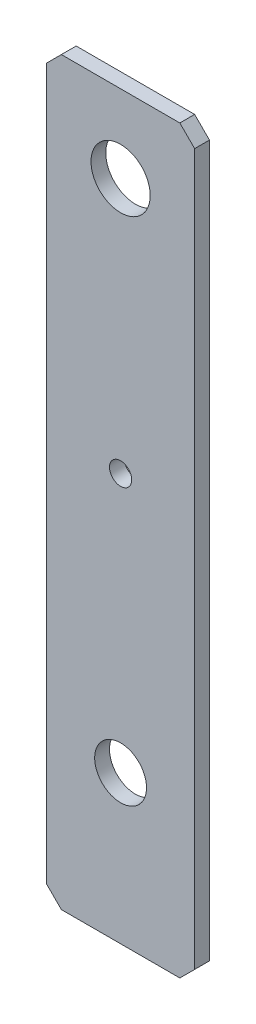
from build123d import *

# Parameters (mm, degrees)
SKETCH1_W           = 20
SKETCH1_H           = 100
BOSS_EXTRUDE1_DEPTH = 2
CUT_EXTRUDE1_REACH  = 53.029
SKETCH2_R           = 4
SKETCH2_R_2         = 1.5
SKETCH2_R_3         = 3.5
CHAMFER1_SIZE       = 2


with BuildPart() as part:
    # Sketch1 → Boss-Extrude1 (new body)
    with BuildSketch(Plane.XY):
        Rectangle(SKETCH1_W, SKETCH1_H)
    extrude(amount=BOSS_EXTRUDE1_DEPTH)

    # Sketch2 → Cut-Extrude1 (cut, up to next)
    with BuildSketch(Plane.XY.offset(2), mode=Mode.PRIVATE) as cut_extrude1_sk1:
        with Locations((0, 39.5)):
            Circle(SKETCH2_R)
    cut_extrude1_tool1 = extrude(cut_extrude1_sk1.sketch, amount=-CUT_EXTRUDE1_REACH, mode=Mode.PRIVATE) & part.part
    # Sketch2 → Cut-Extrude1 (cut, up to next)
    with BuildSketch(Plane.XY.offset(2), mode=Mode.PRIVATE) as cut_extrude1_sk2:
        with Locations((0, 5)):
            Circle(SKETCH2_R_2)
    cut_extrude1_tool2 = extrude(cut_extrude1_sk2.sketch, amount=-CUT_EXTRUDE1_REACH, mode=Mode.PRIVATE) & part.part
    # Sketch2 → Cut-Extrude1 (cut, up to next)
    with BuildSketch(Plane.XY.offset(2), mode=Mode.PRIVATE) as cut_extrude1_sk3:
        with Locations((0, -30)):
            Circle(SKETCH2_R_3)
    cut_extrude1_tool3 = extrude(cut_extrude1_sk3.sketch, amount=-CUT_EXTRUDE1_REACH, mode=Mode.PRIVATE) & part.part
    add(cut_extrude1_tool1.solids().sort_by_distance((0, 39.5, 2))[0], mode=Mode.SUBTRACT)
    add(cut_extrude1_tool2.solids().sort_by_distance((0, 5, 2))[0], mode=Mode.SUBTRACT)
    add(cut_extrude1_tool3.solids().sort_by_distance((0, -30, 2))[0], mode=Mode.SUBTRACT)

    # Chamfer1
    chamfer1_edges = [part.edges().sort_by_distance(p)[0] for p in [
        (10, -50, 1),
        (-10, -50, 1),
        (-10, 50, 1),
        (10, 50, 1),
    ]]
    chamfer(chamfer1_edges, length=CHAMFER1_SIZE)


solid = part.part
